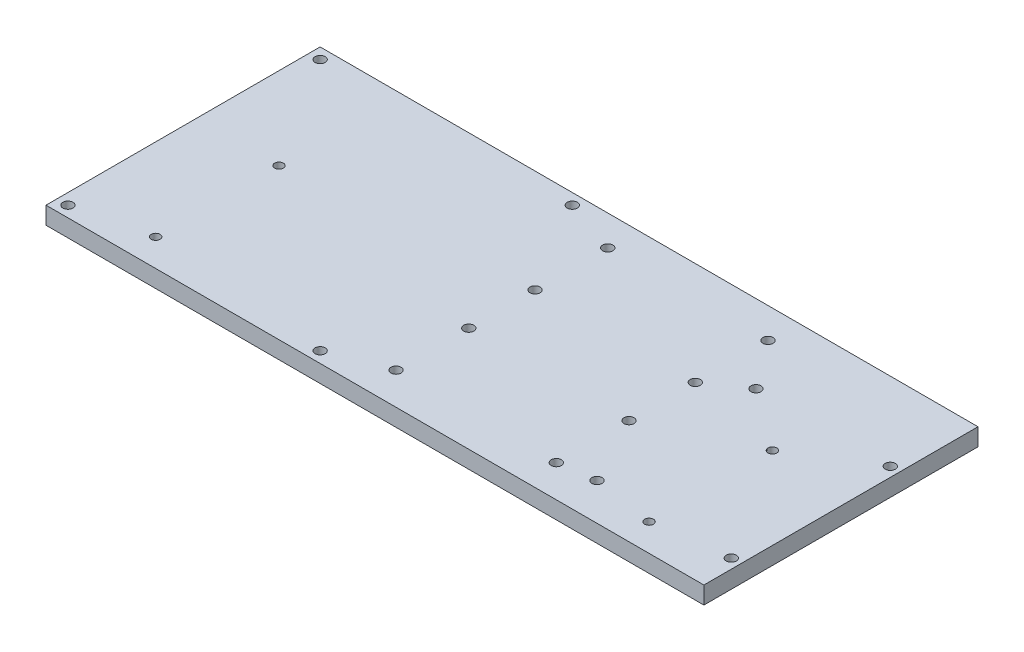
from build123d import *

# Parameters (mm, degrees)
SKETCH1_W                       = 240
SKETCH1_H                       = 100
BOSS_EXTRUDE1_DEPTH             = 6.35
F_3_0MM_CLEARANCE_DOWEL_HOLE2_D = 3.7
SKETCH6_R                       = 1.6
CUT_EXTRUDE1_DEPTH              = 131.154994142


with BuildPart() as part:
    # Sketch1 → Boss-Extrude1 (new body)
    with BuildSketch(Plane(origin=(0, 0, 0), x_dir=(1, 0, 0), z_dir=(0, 1, 0))):
        Rectangle(SKETCH1_W, SKETCH1_H)
    extrude(amount=BOSS_EXTRUDE1_DEPTH)

    # Ø3.0mm Clearance Dowel Hole2 (through all)
    with Locations(Plane(origin=(-50.304100292, 0, 69.560858654), x_dir=(-1, 0, 0), z_dir=(0, -1, 0))):
        with Locations((-46.279100292, 82.000858654), (-26.304100292, 115.560858654), (-46.279100292, 108.520858654), (-46.279100292, 57.820858654), (-46.279100292, 31.300858654), (-26.304100292, 23.560858654), (65.695899708, 23.560858654), (-104.729100292, 31.300858654), (-104.729100292, 57.820858654), (-104.729100292, 82.000858654), (-104.729100292, 108.520858654), (-166.804100292, 33.060858654), (-166.804100292, 91.060858654), (-117.804100292, 91.060858654), (-117.804100292, 33.060858654), (65.695899708, 115.560858654)):
            Hole(F_3_0MM_CLEARANCE_DOWEL_HOLE2_D / 2)

    # Sketch6 → Cut-Extrude1 (cut, through all)
    with BuildSketch(Plane(origin=(0, 6.35, 0), x_dir=(1, 0, 0), z_dir=(0, 1, 0))):
        with Locations(Location((-90, 5, 0), (0, 0, 270))):
            Circle(SKETCH6_R)
        with Locations(Location((-90, -40, 0), (0, 0, 270))):
            Circle(SKETCH6_R)
        with Locations(Location((90, 5, 0), (0, 0, 270))):
            Circle(SKETCH6_R)
        with Locations(Location((90, -40, 0), (0, 0, 270))):
            Circle(SKETCH6_R)
    extrude(amount=-CUT_EXTRUDE1_DEPTH, mode=Mode.SUBTRACT)


solid = part.part
